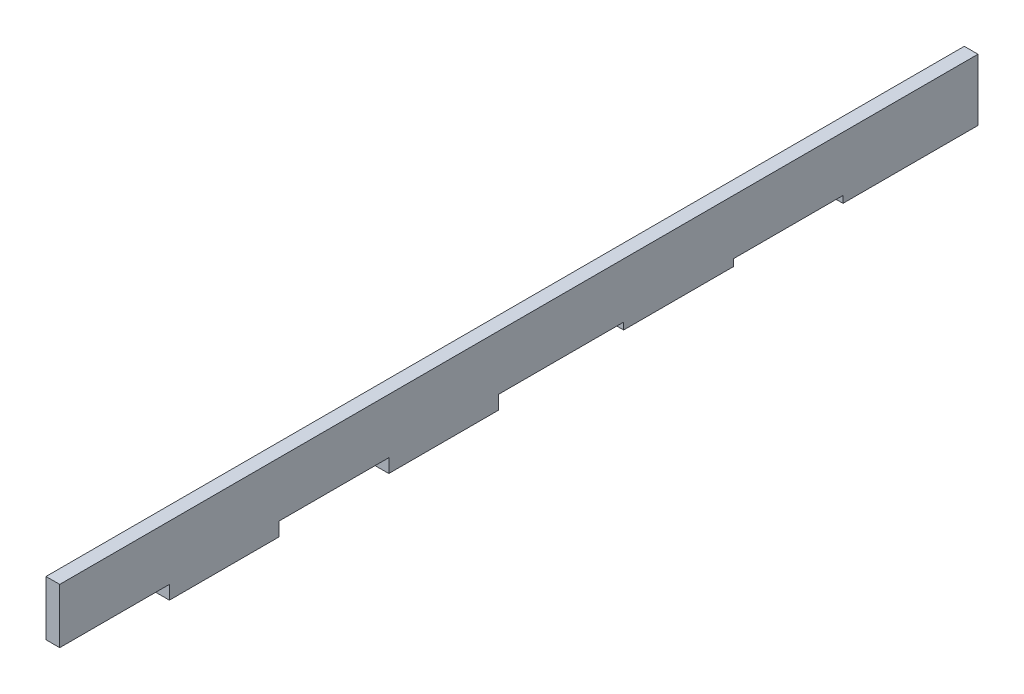
from build123d import *

# Parameters (mm, degrees)
BOSS_EXTRUDE1_DEPTH = 6.35


with BuildPart() as part:
    # Sketch2 → Boss-Extrude1 (new body)
    with BuildSketch(Plane(origin=(0, 0, 0), x_dir=(0, 0, -1), z_dir=(1, 0, 0))):
        Polygon((227.519405744, 6.35), (258.679378365, 6.35), (258.679378365, 3.175), (309.479378365, 3.175), (309.479378365, 6.35), (360.279378365, 6.35), (360.279378365, 3.175), (422.789544579, 3.175), (422.789544579, 31.75), (-2.480594256, 31.75), (-2.480594256, 6.35), (48.319405744, 6.35), (48.319405744, 0), (99.119405744, 0), (99.119405744, 6.35), (149.919405744, 6.35), (149.919405744, 0), (200.719405744, 0), (200.719405744, 6.35), align=None)
    extrude(amount=BOSS_EXTRUDE1_DEPTH)


solid = part.part
